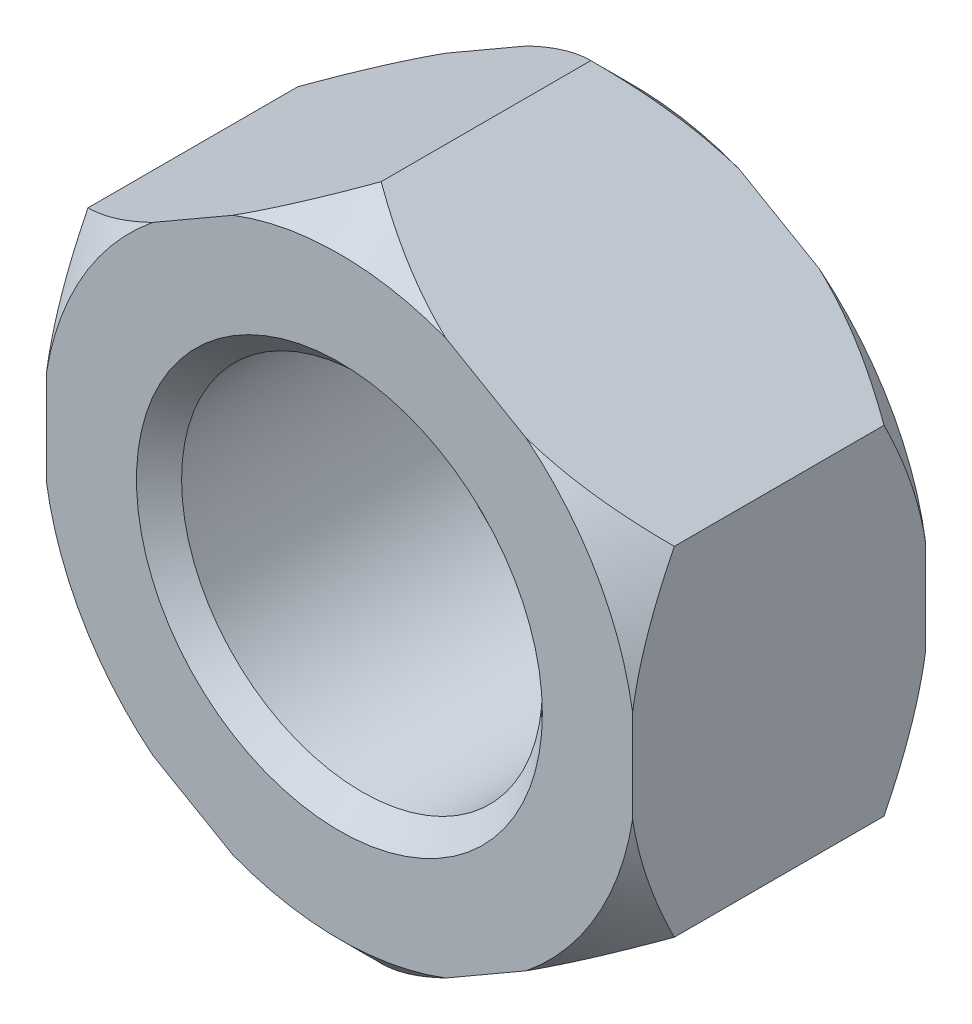
from build123d import *

# Parameters (mm, degrees)
EXTRUDE_1_DEPTH     = 6.5
SKETCH_2_R          = 4
CUT_EXTRUDE_1_DEPTH = 12.867322079
CHAMFER_1_SIZE      = 0.5


with BuildPart() as part:
    # Эскиз1 → Вытянуть1 (new body)
    with BuildSketch(Plane.XY):
        Polygon((0, 7.505553499), (-6.5, 3.75277675), (-6.5, -3.75277675), (0, -7.505553499), (6.5, -3.75277675), (6.5, 3.75277675), align=None)
    extrude(amount=EXTRUDE_1_DEPTH)

    # Эскиз15 → Вырез-Повернуть1 (revolve, cut)
    with BuildSketch(Plane(origin=(0, 0, 0), x_dir=(0, 0, -1), z_dir=(1, 0, 0))):
        Polygon((-6.5, 7.505553499), (-6.5, 6.580553499), (-5.575, 7.505553499), align=None)
        Polygon((-0.925, 7.505553499), (0, 7.505553499), (0, 6.580553499), align=None)
    revolve(axis=Axis((0, 0, 2.633835381), (0, 0, -1)), mode=Mode.SUBTRACT)

    # Эскиз2 → Вырез-Вытянуть1 (cut, through all)
    with BuildSketch(Plane(origin=(0, 0, 0), x_dir=(-1, 0, 0), z_dir=(0, 0, -1))):
        Circle(SKETCH_2_R)
    extrude(amount=-CUT_EXTRUDE_1_DEPTH, mode=Mode.SUBTRACT)

    # Фаска1
    chamfer_1_edges = [part.edges().sort_by_distance(p)[0] for p in [
        (4, 0, 6.5),
        (4, 0, 0),
    ]]
    chamfer(chamfer_1_edges, length=CHAMFER_1_SIZE)


solid = part.part
